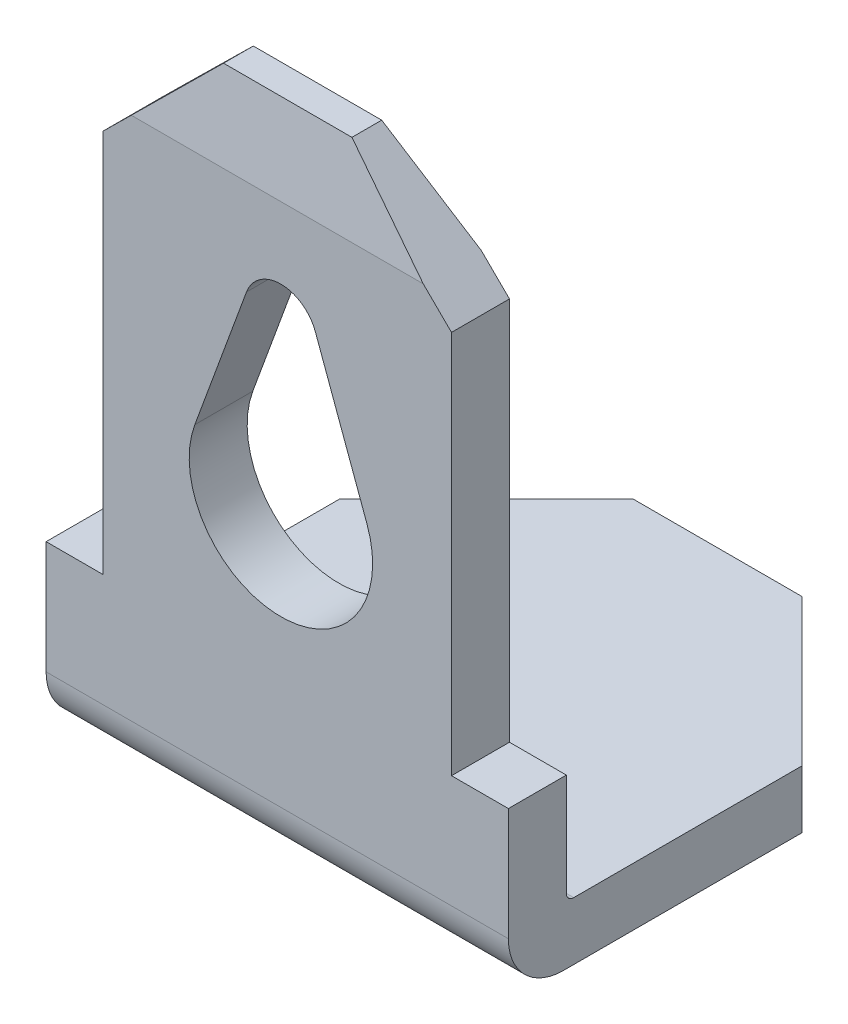
from build123d import *

# Parameters (mm, degrees)
BOSS_EXTRUDE1_DEPTH     = 6.3
CHAMFER3_SIZE           = 2
CUT_EXTRUDE2_DEPTH      = 0.79
CUT_EXTRUDE4_START      = -0.79
SKETCH6_W               = 0.775
SKETCH6_H               = 6.713276343
CUT_EXTRUDE4_DEPTH      = 0.79
CUT_EXTRUDE6_DEPTH      = 12.586121007
CUT_EXTRUDE6_DEPTH_BACK = 12.586121007


with BuildPart() as part:
    # Sketch1 → Boss-Extrude1 (new body)
    with BuildSketch(Plane(origin=(0, 0, 0), x_dir=(0, 0, -1), z_dir=(1, 0, 0))):
        with BuildLine():
            Line((0, 0.1), (0, 7.11))
            Line((0, 7.11), (-0.241393443, 8.21))
            Line((-0.241393443, 8.21), (-0.647131148, 8.21))
            Line((-0.647131148, 8.21), (-0.79, 7.11))
            Line((-0.79, 7.11), (-0.79, -0.04))
            ThreePointArc((-0.79, -0.04), (-0.570330086, -0.570330086), (-0.04, -0.79))
            Line((-0.04, -0.79), (5.21, -0.79))
            Line((5.21, -0.79), (5.21, 0))
            Line((5.21, 0), (0.1, 0))
            ThreePointArc((0.1, 0), (0.029289322, 0.029289322), (0, 0.1))
        make_face()
    extrude(amount=BOSS_EXTRUDE1_DEPTH)

    # Chamfer3
    chamfer3_edges = [part.edges().sort_by_distance(p)[0] for p in [
        (0, -0.395, -5.21),
        (6.3, -0.395, -5.21),
    ]]
    chamfer(chamfer3_edges, length=CHAMFER3_SIZE)

    # Sketch5 → Cut-Extrude2 (cut)
    with BuildSketch(Plane.XY.offset(0.79)):
        with BuildLine():
            Line((2.730622244, 5.808829869), (2.026555611, 3.890729922))
            ThreePointArc((2.026555611, 3.890729922), (3.20000017, 2.21), (4.373444272, 3.890730241))
            Line((4.373444272, 3.890730241), (3.669633952, 5.808130298))
            ThreePointArc((3.669633952, 5.808130298), (3.200372504, 6.136537762), (2.730622244, 5.808829869))
        make_face()
    extrude(amount=-CUT_EXTRUDE2_DEPTH, mode=Mode.SUBTRACT)

    # Sketch6 → Cut-Extrude4 (cut)
    with BuildSketch(Plane(origin=(0, 0, 0), x_dir=(-1, 0, 0), z_dir=(0, 0, -1)).offset(CUT_EXTRUDE4_START)):
        with Locations((-5.9125, 4.853361829)):
            Rectangle(SKETCH6_W, SKETCH6_H)
        with Locations((-0.3875, 4.853361829)):
            Rectangle(SKETCH6_W, SKETCH6_H)
    extrude(amount=CUT_EXTRUDE4_DEPTH, mode=Mode.SUBTRACT)

    # Sketch4 → Cut-Extrude6 (cut, two sides: drawn at the far end of the back side and taken through both)
    with BuildSketch(Plane.XY.offset(-CUT_EXTRUDE6_DEPTH_BACK)):
        Polygon((2.275, 8.21), (0.775, 8.21), (0.755504439, 6.71), align=None)
        Polygon((5.544495561, 6.71), (4.025, 8.21), (5.525, 8.21), align=None)
    extrude(amount=CUT_EXTRUDE6_DEPTH + CUT_EXTRUDE6_DEPTH_BACK, mode=Mode.SUBTRACT)


solid = part.part
